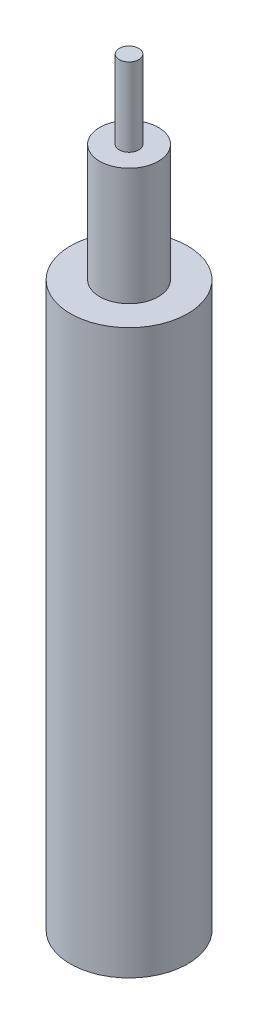
from build123d import *

# Parameters (mm, degrees)
SKETCH1_R           = 2.38125
BOSS_EXTRUDE1_DEPTH = 9.525
SKETCH2_R           = 4.7625
BOSS_EXTRUDE2_DEPTH = 45.72
SKETCH3_R           = 0.79375
BOSS_EXTRUDE3_DEPTH = 6.35


with BuildPart() as part:
    # Sketch1 → Boss-Extrude1 (new body)
    with BuildSketch(Plane(origin=(0, 0, 0), x_dir=(1, 0, 0), z_dir=(0, 1, 0))):
        with Locations(Location((0, 0, 0), (0, 0, 270))):
            Circle(SKETCH1_R)
    extrude(amount=-BOSS_EXTRUDE1_DEPTH)

    # Sketch2 → Boss-Extrude2 (add)
    with BuildSketch(Plane(origin=(0, -9.525, 0), x_dir=(-1, 0, 0), z_dir=(0, -1, 0))):
        with Locations(Location((0, 0, 0), (0, 0, 90))):
            Circle(SKETCH2_R)
    extrude(amount=BOSS_EXTRUDE2_DEPTH)

    # Sketch3 → Boss-Extrude3 (add)
    with BuildSketch(Plane(origin=(0, 0, 0), x_dir=(1, 0, 0), z_dir=(0, 1, 0))):
        with Locations(Location((0, 0, 0), (0, 0, 270))):
            Circle(SKETCH3_R)
    extrude(amount=BOSS_EXTRUDE3_DEPTH)


solid = part.part
